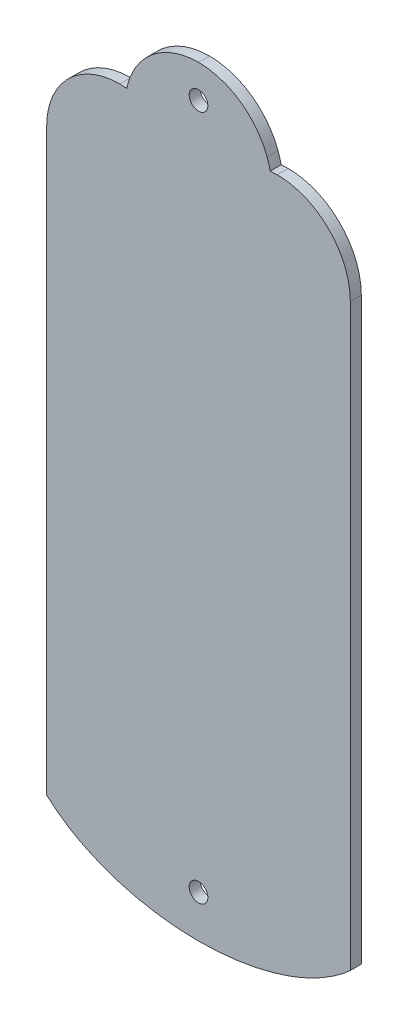
from build123d import *

# Parameters (mm, degrees)
SKETCH_1_R      = 2.55
EXTRUDE_1_DEPTH = 3


with BuildPart() as part:
    # 草图1 → 凸台-拉伸1 (new body)
    with BuildSketch(Plane.XY):
        with BuildLine():
            Line((-41.500782935, 68.140791219), (-41.500782935, -90.245837295))
            add(Edge.make_bspline(
                [(-41.500782935, -90.245837295), (-38.389280352, -93.089225322), (-34.568690991, -95.593960463), (-30.197769157, -97.664764295)],
                knots=[11, 11, 11, 11, 12, 12, 12, 12], degree=3))
            add(Edge.make_bspline(
                [(-30.197769157, -97.664764295), (-21.780496549, -101.6546801), (-11.324158051, -104.014764294), (0, -104.014764294)],
                knots=[12, 12, 12, 12, 13, 13, 13, 13], degree=3))
            add(Edge.make_bspline(
                [(0, -104.014764294), (11.324158051, -104.014764294), (21.780496549, -101.6546801), (30.197769157, -97.664764295)],
                knots=[13, 13, 13, 13, 14, 14, 14, 14], degree=3))
            add(Edge.make_bspline(
                [(30.197769157, -97.664764295), (34.568690991, -95.593960463), (38.389280352, -93.089225322), (41.500782935, -90.245837295)],
                knots=[14, 14, 14, 14, 15, 15, 15, 15], degree=3))
            Line((41.500782935, -90.245837295), (41.500782935, 68.140791219))
            add(Edge.make_bspline(
                [(41.500782935, 68.140791219), (41.500782935, 79.186262577), (32.547281215, 88.139764297), (21.501809857, 88.139764297)],
                knots=[0, 0, 0, 0, 1, 1, 1, 1], degree=3))
            add(Edge.make_bspline(
                [(21.501809857, 88.139764297), (20.859751717, 88.139764297), (20.221224801, 88.108026355), (19.593270021, 88.04803863)],
                knots=[1, 1, 1, 1, 2, 2, 2, 2], degree=3))
            add(Edge.make_bspline(
                [(19.593270021, 88.04803863), (19.388674413, 89.04640577), (19.106434966, 90.020075881), (18.760719634, 90.961986519)],
                knots=[2, 2, 2, 2, 3, 3, 3, 3], degree=3))
            add(Edge.make_bspline(
                [(18.760719634, 90.961986519), (15.938497412, 98.581999436), (8.604255165, 104.014764294), (0, 104.014764294)],
                knots=[3, 3, 3, 3, 4, 4, 4, 4], degree=3))
            add(Edge.make_bspline(
                [(0, 104.014764294), (-8.604255165, 104.014764294), (-15.938497412, 98.581999436), (-18.760719634, 90.961986519)],
                knots=[4, 4, 4, 4, 5, 5, 5, 5], degree=3))
            add(Edge.make_bspline(
                [(-18.760719634, 90.961986519), (-19.106456498, 90.020075881), (-19.388674413, 89.04640577), (-19.593270021, 88.04803863)],
                knots=[5, 5, 5, 5, 6, 6, 6, 6], degree=3))
            add(Edge.make_bspline(
                [(-19.593270021, 88.04803863), (-20.221224801, 88.108026355), (-20.856220494, 88.139764297), (-21.498278634, 88.139764297)],
                knots=[6, 6, 6, 6, 7, 7, 7, 7], degree=3))
            add(Edge.make_bspline(
                [(-21.498278634, 88.139764297), (-32.547281215, 88.139764297), (-41.500782935, 79.186262577), (-41.500782935, 68.140791219)],
                knots=[7, 7, 7, 7, 8, 8, 8, 8], degree=3))
        make_face()
        with Locations((0, 95)):
            Circle(SKETCH_1_R, mode=Mode.SUBTRACT)
        with Locations((0, -92.443657492)):
            Circle(SKETCH_1_R, mode=Mode.SUBTRACT)
    extrude(amount=EXTRUDE_1_DEPTH)


solid = part.part
